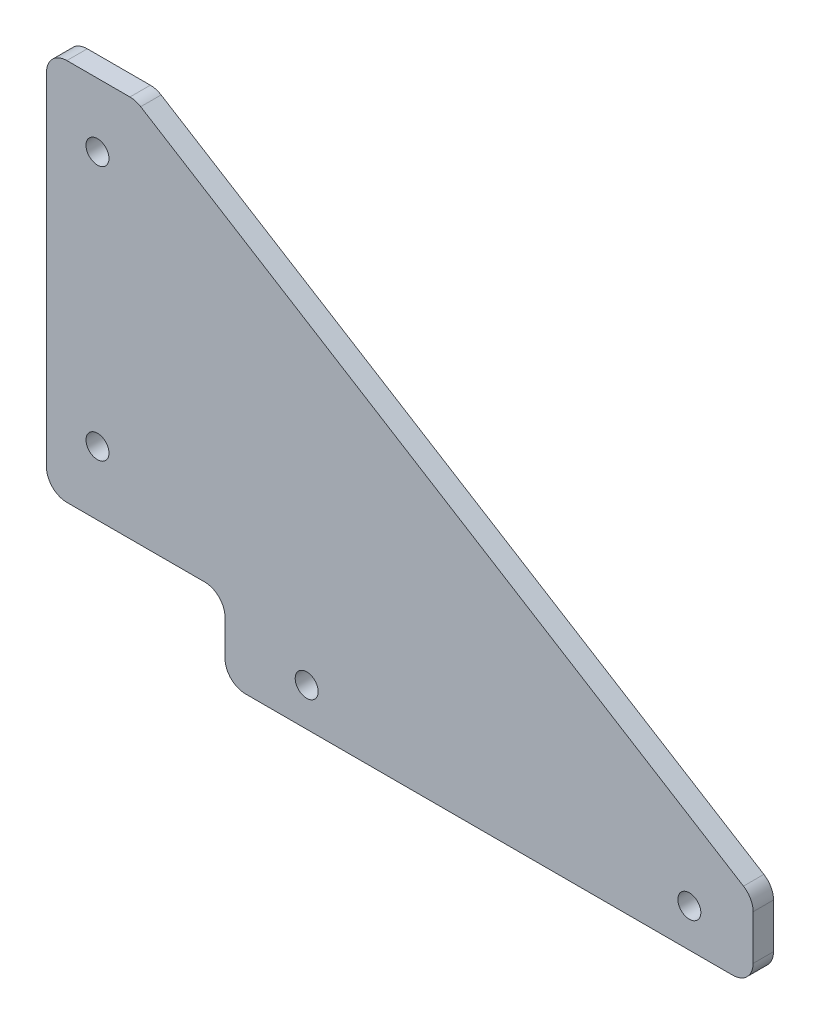
from build123d import *

# Parameters (mm, degrees)
SKETCH1_R           = 4.5
BOSS_EXTRUDE1_DEPTH = 8


with BuildPart() as part:
    # Sketch1 → Boss-Extrude1 (new body)
    with BuildSketch(Plane.XY):
        with BuildLine():
            Line((-119.390660592, 123.251708428), (-119.390660592, -10.748291572))
            ThreePointArc((-119.390660592, -10.748291572), (-117.047514842, -16.405145821), (-111.390660592, -18.748291572))
            Line((-111.390660592, -18.748291572), (-57.390660592, -18.748291572))
            ThreePointArc((-57.390660592, -18.748291572), (-51.733806343, -21.091437322), (-49.390660592, -26.748291572))
            Line((-49.390660592, -26.748291572), (-49.390660592, -40.748291572))
            ThreePointArc((-49.390660592, -40.748291572), (-47.047514842, -46.405145821), (-41.390660592, -48.748291572))
            Line((-41.390660592, -48.748291572), (149.609339408, -48.748291572))
            ThreePointArc((149.609339408, -48.748291572), (155.266193657, -46.405145821), (157.609339408, -40.748291572))
            Line((157.609339408, -40.748291572), (157.609339408, -23.201759464))
            ThreePointArc((157.609339408, -23.201759464), (156.599247983, -19.310592788), (153.824044881, -16.402034634))
            Line((153.824044881, -16.402034634), (-82.454216652, 130.051433259))
            ThreePointArc((-82.454216652, 130.051433259), (-84.477780716, 130.945790526), (-86.668922126, 131.251708428))
            Line((-86.668922126, 131.251708428), (-111.390660592, 131.251708428))
            ThreePointArc((-111.390660592, 131.251708428), (-117.047514842, 128.908562678), (-119.390660592, 123.251708428))
        make_face()
        with Locations((-99.390660592, 106.251708428)):
            Circle(SKETCH1_R, mode=Mode.SUBTRACT)
        with Locations((-99.390660592, 6.251708428)):
            Circle(SKETCH1_R, mode=Mode.SUBTRACT)
        with Locations((-17.390660592, -33.748291572)):
            Circle(SKETCH1_R, mode=Mode.SUBTRACT)
        with Locations((132.609339408, -33.748291572)):
            Circle(SKETCH1_R, mode=Mode.SUBTRACT)
    extrude(amount=BOSS_EXTRUDE1_DEPTH)


solid = part.part
